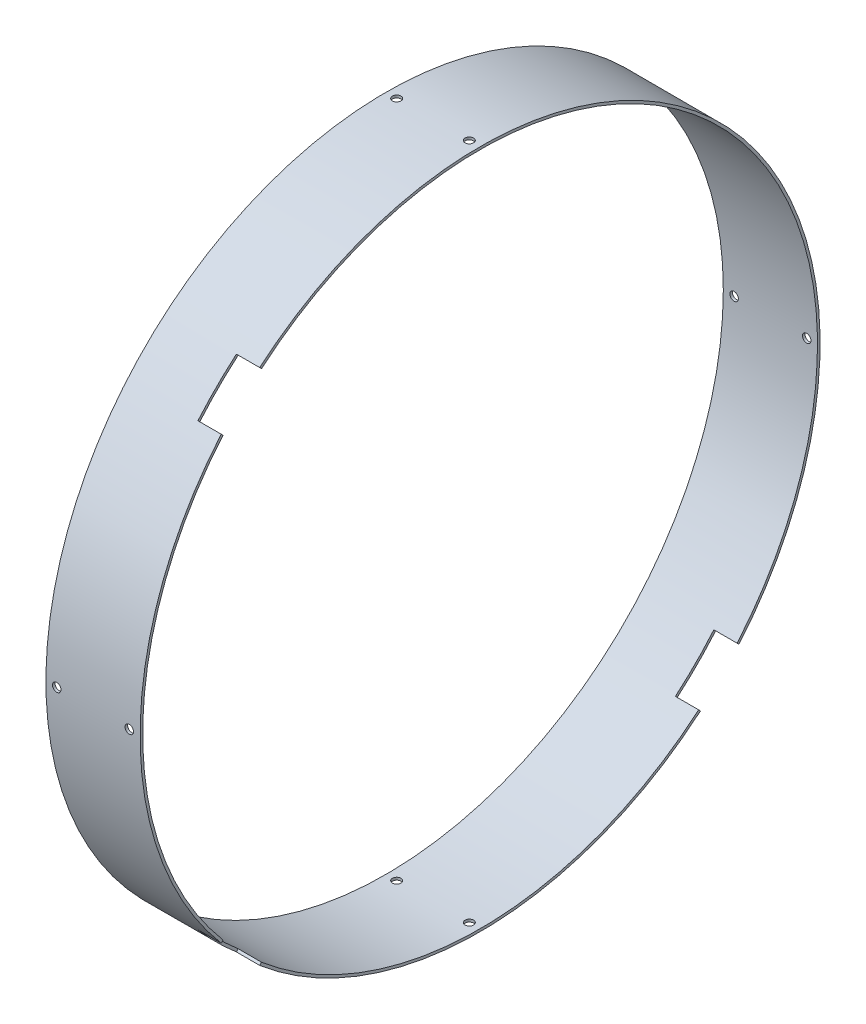
from build123d import *

# Parameters (mm, degrees)
SKETCH1_R               = 100
SKETCH1_R_2             = 99.238
BOSS_EXTRUDE1_DEPTH     = 27.7
F_2_5MM_DOWEL_HOLE1_D   = 2.5
F_2_5MM_DOWEL_HOLE2_D   = 2.5
SKETCH6_W               = 7.35
SKETCH6_H               = 16
CUT_EXTRUDE1_DEPTH      = 145.108605038
CUT_EXTRUDE2_DEPTH      = 145.108605038
CUT_EXTRUDE2_DEPTH_BACK = 145.108605038
SKETCH7_W               = 7.35
SKETCH7_H               = 16


with BuildPart() as part:
    # Sketch1 → Boss-Extrude1 (new body)
    with BuildSketch(Plane(origin=(0, 0, 0), x_dir=(0, 0, -1), z_dir=(1, 0, 0))):
        Circle(SKETCH1_R)
        Circle(SKETCH1_R_2, mode=Mode.SUBTRACT)
    extrude(amount=BOSS_EXTRUDE1_DEPTH)

    # Ø2.5mm Dowel Hole1 (through all)
    with Locations(Plane.XY.offset(100)):
        with Locations((24.525, 0), (3.175, 0)):
            Hole(F_2_5MM_DOWEL_HOLE1_D / 2)

    # Ø2.5mm Dowel Hole2 (through all)
    with Locations(Plane(origin=(0, 100, 0), x_dir=(1, 0, 0), z_dir=(0, 1, 0))):
        with Locations((24.525, 0), (3.175, 0)):
            Hole(F_2_5MM_DOWEL_HOLE2_D / 2)

    # Sketch6 → Cut-Extrude1 (cut, through all)
    with BuildSketch(Plane(origin=(0, 0, 0), x_dir=(-1, 0, 0), z_dir=(0, 0.7071067811865475, -0.7071067811865477))):
        with Locations((-24.525, 0)):
            Rectangle(SKETCH6_W, SKETCH6_H)
    extrude(amount=-CUT_EXTRUDE1_DEPTH, mode=Mode.SUBTRACT)

    # Sketch7 → Cut-Extrude2 (cut, two sides: drawn at the far end of the back side and taken through both)
    with BuildSketch(Plane(origin=(0, 0, 0), x_dir=(-1, 0, 0), z_dir=(0, 0.7071067811865476, 0.7071067811865476)).offset(-CUT_EXTRUDE2_DEPTH_BACK)):
        with Locations((-24.525, 0)):
            Rectangle(SKETCH7_W, SKETCH7_H)
    extrude(amount=CUT_EXTRUDE2_DEPTH + CUT_EXTRUDE2_DEPTH_BACK, mode=Mode.SUBTRACT)


solid = part.part
